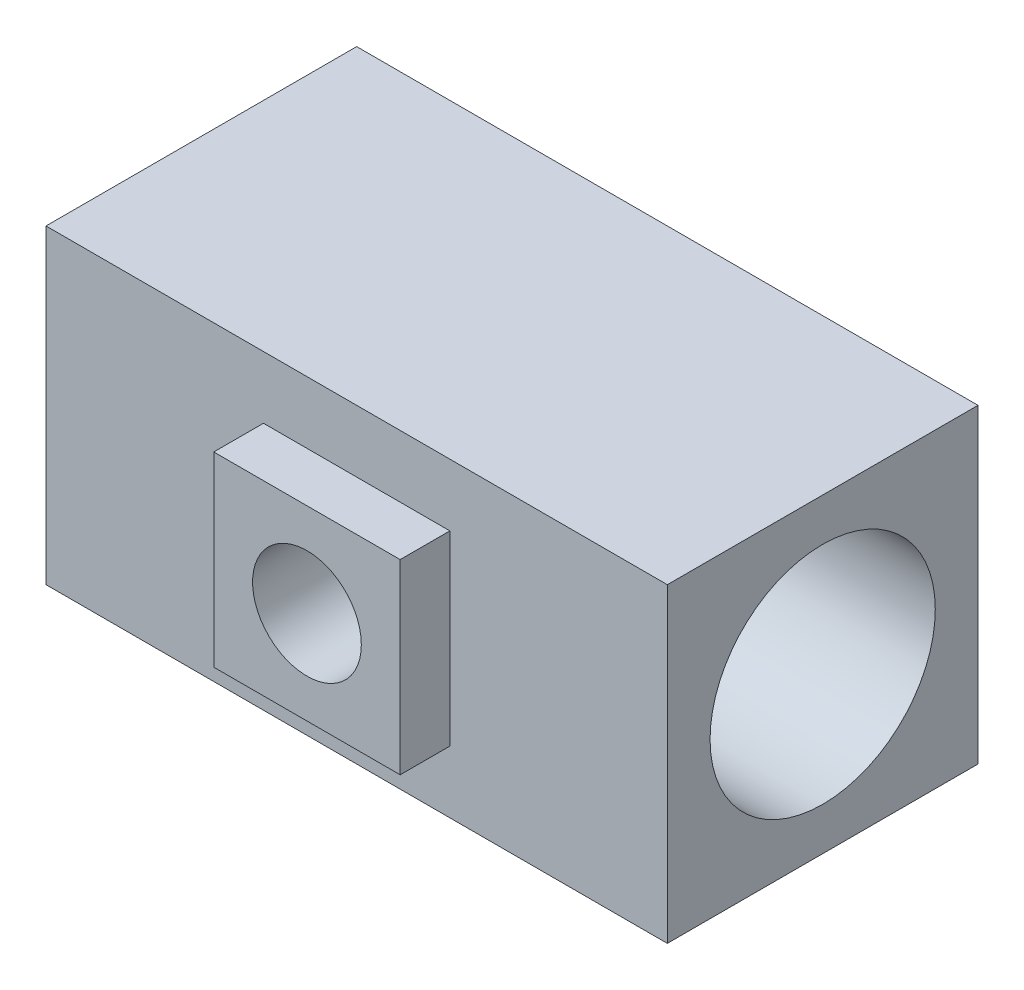
from build123d import *

# Parameters (mm, degrees)
SKETCH2_W                          = 63.5
SKETCH2_H                          = 31.75
BOSS_EXTRUDE1_DEPTH                = 31.75
F_29_32_0_90625_DIAMETER_HOLE1_D   = 23.01875
BOSS_EXTRUDE2_DEPTH                = 5.08
F_7_16_0_4375_DIAMETER_HOLE1_D     = 11.1125
F_7_16_0_4375_DIAMETER_HOLE1_DEPTH = 25.4
F_7_16_0_4375_DIAMETER_HOLE1_TIP   = 3.338531814


with BuildPart() as part:
    # Sketch2 → Boss-Extrude1 (new body)
    with BuildSketch(Plane(origin=(0, 0, 0), x_dir=(1, 0, 0), z_dir=(0, 1, 0))):
        Rectangle(SKETCH2_W, SKETCH2_H)
    extrude(amount=BOSS_EXTRUDE1_DEPTH)

    # 29/32 (0.90625) Diameter Hole1 (through all)
    with Locations(Plane(origin=(31.75, 0, 0), x_dir=(0, 0, -1), z_dir=(1, 0, 0))):
        with Locations((0, 15.875)):
            Hole(F_29_32_0_90625_DIAMETER_HOLE1_D / 2)

    # Sketch10 → Boss-Extrude2 (add)
    with BuildSketch(Plane.XY.offset(15.875)):
        Polygon((9.525, 11.1125), (-9.525, 20.6375), (-9.525, 6.35), (9.525, 6.35), align=None)
        Polygon((-9.525, 25.4), (-9.525, 20.6375), (9.525, 11.1125), (9.525, 25.4), align=None)
    extrude(amount=BOSS_EXTRUDE2_DEPTH)

    # 7/16 (0.4375) Diameter Hole1
    with Locations(Plane.XY.offset(20.955)):
        with Locations((0, 15.875)):
            Hole(F_7_16_0_4375_DIAMETER_HOLE1_D / 2, depth=F_7_16_0_4375_DIAMETER_HOLE1_DEPTH)
            with Locations((0, 0, -(F_7_16_0_4375_DIAMETER_HOLE1_DEPTH + F_7_16_0_4375_DIAMETER_HOLE1_TIP / 2))):  # 118° drill point
                Cone(0, F_7_16_0_4375_DIAMETER_HOLE1_D / 2, F_7_16_0_4375_DIAMETER_HOLE1_TIP, mode=Mode.SUBTRACT)


solid = part.part
